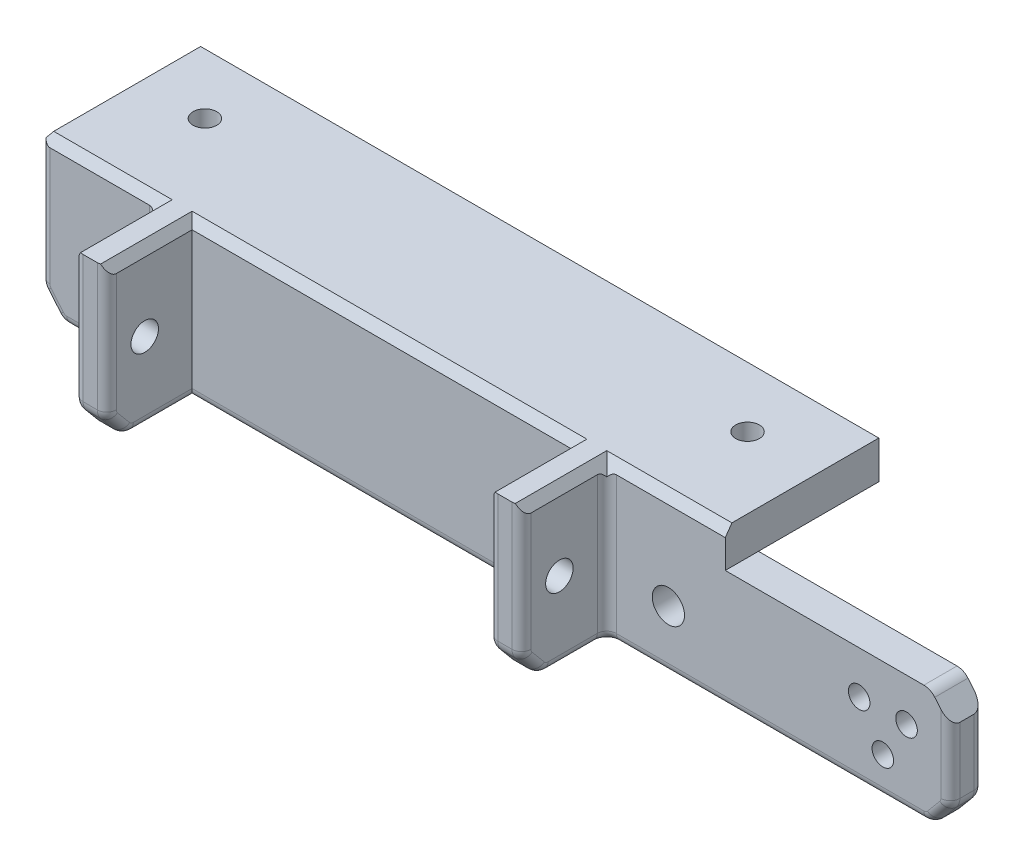
from build123d import *
from OCP.BRepFilletAPI import BRepFilletAPI_MakeChamfer

# Parameters (mm, degrees)
BOSS_EXTRUDE1_DEPTH = 12.5
SKETCH2_R           = 3.4
CUT_EXTRUDE1_DEPTH  = 122.738705842
SKETCH4_R           = 2.5
BOSS_EXTRUDE2_DEPTH = 8
SKETCH3_R           = 2.9
CUT_EXTRUDE2_DEPTH  = 171.159954161
CUT_EXTRUDE4_REACH  = 127.738
SKETCH8_R           = 2.275
CHAMFER1_SIZE       = 5
CHAMFER1_SIZE2      = 4.195498156
FILLET1_R           = 3
CHAMFER2_SIZE       = 2
CHAMFER2_SIZE2      = 1.400415076
FILLET2_R           = 2


with BuildPart() as part:
    # Sketch1 → Boss-Extrude1 (new, symmetric)
    with BuildSketch(Plane(origin=(0, 0, 0), x_dir=(1, 0, 0), z_dir=(0, 1, 0))):
        Polygon((119.75, 0), (119.75, -7), (47.25, -7), (47.25, -25), (40.25, -25), (40.25, -7), (-40.25, -7), (-40.25, -25), (-47.25, -25), (-47.25, -7), (-72.25, -7), (-72.25, 0), align=None)
    extrude(amount=BOSS_EXTRUDE1_DEPTH, both=True)

    # Sketch2 → Cut-Extrude1 (cut, through all)
    with BuildSketch(Plane.XY.offset(7)):
        with Locations((-60.25, 0)):
            Circle(SKETCH2_R)
        with Locations(Location((60.25, 0, 0), (0, 0, 180))):
            Circle(SKETCH2_R)
    extrude(amount=-CUT_EXTRUDE1_DEPTH, mode=Mode.SUBTRACT)

    # Sketch4 → Boss-Extrude2 (add)
    with BuildSketch(Plane(origin=(0, 12.5, 0), x_dir=(1, 0, 0), z_dir=(0, 1, 0))):
        Polygon((-72.25, -7), (-47.25, -7), (-47.25, -25), (-40.25, -25), (-40.25, -7), (40.25, -7), (40.25, -25), (47.25, -25), (47.25, -7), (72.25, -7), (72.25, 25.4), (-72.25, 25.4), align=None)
        with Locations(Location((-57.25, 12.7, 0), (0, 0, 270))):
            Circle(SKETCH4_R, mode=Mode.SUBTRACT)
        with Locations(Location((57.25, 12.7, 0), (0, 0, 270))):
            Circle(SKETCH4_R, mode=Mode.SUBTRACT)
    extrude(amount=BOSS_EXTRUDE2_DEPTH)

    # Sketch3 → Cut-Extrude2 (cut, through all)
    with BuildSketch(Plane.ZY.offset(47.25)):
        with Locations((17, 4)):
            Circle(SKETCH3_R)
    extrude(amount=-CUT_EXTRUDE2_DEPTH, mode=Mode.SUBTRACT)

    # Sketch8 → Cut-Extrude4 (cut, up to next)
    with BuildSketch(Plane.XY.offset(7), mode=Mode.PRIVATE) as cut_extrude4_sk1:
        with Locations((100.5, 3.5)):
            Circle(SKETCH8_R)
    cut_extrude4_tool1 = extrude(cut_extrude4_sk1.sketch, amount=-CUT_EXTRUDE4_REACH, mode=Mode.PRIVATE) & part.part
    # Sketch8 → Cut-Extrude4 (cut, up to next)
    with BuildSketch(Plane.XY.offset(7), mode=Mode.PRIVATE) as cut_extrude4_sk2:
        with Locations((110.5, 3.5)):
            Circle(SKETCH8_R)
    cut_extrude4_tool2 = extrude(cut_extrude4_sk2.sketch, amount=-CUT_EXTRUDE4_REACH, mode=Mode.PRIVATE) & part.part
    # Sketch8 → Cut-Extrude4 (cut, up to next)
    with BuildSketch(Plane.XY.offset(7), mode=Mode.PRIVATE) as cut_extrude4_sk3:
        with Locations((105.5, -4.5)):
            Circle(SKETCH8_R)
    cut_extrude4_tool3 = extrude(cut_extrude4_sk3.sketch, amount=-CUT_EXTRUDE4_REACH, mode=Mode.PRIVATE) & part.part
    add(cut_extrude4_tool1.solids().sort_by_distance((100.5, 3.5, 7))[0], mode=Mode.SUBTRACT)
    add(cut_extrude4_tool2.solids().sort_by_distance((110.5, 3.5, 7))[0], mode=Mode.SUBTRACT)
    add(cut_extrude4_tool3.solids().sort_by_distance((105.5, -4.5, 7))[0], mode=Mode.SUBTRACT)

    # Chamfer1: one chamfer whose edges measure the first distance from different faces: ONE call of the kernel's chamfer builder (chamfer() names one face for all edges)
    chamfer1_edges_1 = [part.edges().sort_by_distance(p)[0] for p in [
        (119.75, -12.5, 3.5),
        (119.75, 12.5, 3.5),
    ]]
    chamfer1_side_1 = [part.faces().sort_by_distance(p)[0] for p in [
        (119.75, 0, 3.5),
    ]]
    chamfer1_edges_2 = [part.edges().sort_by_distance(p)[0] for p in [
        (43.75, -12.5, 25),
    ]]
    chamfer1_side_2 = [part.faces().sort_by_distance(p)[0] for p in [
        (43.75, 4, 25),
    ]]
    chamfer1_edges_3 = [part.edges().sort_by_distance(p)[0] for p in [
        (-43.75, -12.5, 25),
    ]]
    chamfer1_side_3 = [part.faces().sort_by_distance(p)[0] for p in [
        (-43.75, 4, 25),
    ]]
    chamfer1_edges_4 = [part.edges().sort_by_distance(p)[0] for p in [
        (-72.25, -12.5, 3.5),
    ]]
    chamfer1_side_4 = [part.faces().sort_by_distance(p)[0] for p in [
        (-72.25, 4, 6.537532704),
    ]]
    chamfer1 = BRepFilletAPI_MakeChamfer(part.part.solid().wrapped)
    for e in chamfer1_edges_1:
        chamfer1.Add(CHAMFER1_SIZE, CHAMFER1_SIZE2, e.wrapped, chamfer1_side_1[0].wrapped)  # the first distance lies on this face
    for e in chamfer1_edges_2:
        chamfer1.Add(CHAMFER1_SIZE, CHAMFER1_SIZE2, e.wrapped, chamfer1_side_2[0].wrapped)  # the first distance lies on this face
    for e in chamfer1_edges_3:
        chamfer1.Add(CHAMFER1_SIZE, CHAMFER1_SIZE2, e.wrapped, chamfer1_side_3[0].wrapped)  # the first distance lies on this face
    for e in chamfer1_edges_4:
        chamfer1.Add(CHAMFER1_SIZE, CHAMFER1_SIZE2, e.wrapped, chamfer1_side_4[0].wrapped)  # the first distance lies on this face
    add(Compound.cast(chamfer1.Shape()), mode=Mode.REPLACE)

    # Fillet1
    fillet1_edges = [part.edges().sort_by_distance(p)[0] for p in [
        (115.554501844, 12.5, 3.5),
        (119.75, -7.5, 3.5),
        (-43.75, -12.5, 20.804501844),
        (43.75, -12.5, 20.804501844),
        (-68.054501844, -12.5, 3.5),
        (115.554501844, -12.5, 3.5),
        (-72.25, -7.5, 3.5),
        (43.75, -7.5, 25),
        (-43.75, -7.5, 25),
    ]]
    fillet(fillet1_edges, radius=FILLET1_R)

    # Chamfer2: one chamfer whose edges measure the first distance from different faces: ONE call of the kernel's chamfer builder (chamfer() names one face for all edges)
    chamfer2_edges_1 = [part.edges().sort_by_distance(p)[0] for p in [
        (-72.25, 20.5, -9.2),
    ]]
    chamfer2_side_1 = [part.faces().sort_by_distance(p)[0] for p in [
        (-72.25, 7.045955351, 6.578834324),
    ]]
    chamfer2_edges_2 = [part.edges().sort_by_distance(p)[0] for p in [
        (-59.75, 20.5, 7),
    ]]
    chamfer2_side_2 = [part.faces().sort_by_distance(p)[0] for p in [
        (-59.571971044, 4.394421722, 7),
    ]]
    chamfer2_edges_3 = [part.edges().sort_by_distance(p)[0] for p in [
        (-47.25, 20.5, 16),
    ]]
    chamfer2_side_3 = [part.faces().sort_by_distance(p)[0] for p in [
        (-47.25, -12.124101077, 13.202789435),
    ]]
    chamfer2_edges_4 = [part.edges().sort_by_distance(p)[0] for p in [
        (-40.25, 20.5, 16),
    ]]
    chamfer2_side_4 = [part.faces().sort_by_distance(p)[0] for p in [
        (-40.25, -12.124101077, 13.202789435),
    ]]
    chamfer2_edges_5 = [part.edges().sort_by_distance(p)[0] for p in [
        (0, 20.5, 7),
    ]]
    chamfer2_side_5 = [part.faces().sort_by_distance(p)[0] for p in [
        (0, 4, 7),
    ]]
    chamfer2_edges_6 = [part.edges().sort_by_distance(p)[0] for p in [
        (40.25, 20.5, 16),
    ]]
    chamfer2_side_6 = [part.faces().sort_by_distance(p)[0] for p in [
        (40.25, -12.124101077, 13.202789435),
    ]]
    chamfer2_edges_7 = [part.edges().sort_by_distance(p)[0] for p in [
        (47.25, 20.5, 16),
    ]]
    chamfer2_side_7 = [part.faces().sort_by_distance(p)[0] for p in [
        (47.25, -12.124101077, 13.202789435),
    ]]
    chamfer2_edges_8 = [part.edges().sort_by_distance(p)[0] for p in [
        (59.75, 20.5, 7),
    ]]
    chamfer2_side_8 = [part.faces().sort_by_distance(p)[0] for p in [
        (80.49228868, 1.71079357, 7),
    ]]
    chamfer2 = BRepFilletAPI_MakeChamfer(part.part.solid().wrapped)
    for e in chamfer2_edges_1:
        chamfer2.Add(CHAMFER2_SIZE, CHAMFER2_SIZE2, e.wrapped, chamfer2_side_1[0].wrapped)  # the first distance lies on this face
    for e in chamfer2_edges_2:
        chamfer2.Add(CHAMFER2_SIZE, CHAMFER2_SIZE2, e.wrapped, chamfer2_side_2[0].wrapped)  # the first distance lies on this face
    for e in chamfer2_edges_3:
        chamfer2.Add(CHAMFER2_SIZE, CHAMFER2_SIZE2, e.wrapped, chamfer2_side_3[0].wrapped)  # the first distance lies on this face
    for e in chamfer2_edges_4:
        chamfer2.Add(CHAMFER2_SIZE, CHAMFER2_SIZE2, e.wrapped, chamfer2_side_4[0].wrapped)  # the first distance lies on this face
    for e in chamfer2_edges_5:
        chamfer2.Add(CHAMFER2_SIZE, CHAMFER2_SIZE2, e.wrapped, chamfer2_side_5[0].wrapped)  # the first distance lies on this face
    for e in chamfer2_edges_6:
        chamfer2.Add(CHAMFER2_SIZE, CHAMFER2_SIZE2, e.wrapped, chamfer2_side_6[0].wrapped)  # the first distance lies on this face
    for e in chamfer2_edges_7:
        chamfer2.Add(CHAMFER2_SIZE, CHAMFER2_SIZE2, e.wrapped, chamfer2_side_7[0].wrapped)  # the first distance lies on this face
    for e in chamfer2_edges_8:
        chamfer2.Add(CHAMFER2_SIZE, CHAMFER2_SIZE2, e.wrapped, chamfer2_side_8[0].wrapped)  # the first distance lies on this face
    add(Compound.cast(chamfer2.Shape()), mode=Mode.REPLACE)

    # Fillet2
    fillet2_edges = [part.edges().sort_by_distance(p)[0] for p in [
        (-72.25, 6.045955351, 7),
        (-72.069077862, -7.434149727, 7),
        (-70.250922764, -9.882407478, 7),
        (-67.923433655, -12.218923361, 7),
        (-56.952789435, -12.5, 7),
        (119.569077862, -7.434149727, 7),
        (117.750922764, -9.882407478, 7),
        (115.423433655, -12.218923361, 7),
        (119.75, 0.545955351, 0),
        (119.569077862, -7.434149727, 0),
        (117.750922764, -9.882407478, 0),
        (115.423433655, -12.218923361, 0),
        (-72.25, 3.045955351, 0),
        (-72.069077862, -7.434149727, 0),
        (-70.250922764, -9.882407478, 0),
        (-67.923433655, -12.218923361, 0),
        (47.25, -12.5, 13.202789435),
        (47.25, -12.218923361, 20.673433655),
        (47.25, -9.882407478, 23.000922764),
        (47.25, -7.434149727, 24.819077862),
        (40.25, -12.5, 13.202789435),
        (40.25, -12.218923361, 20.673433655),
        (40.25, -9.882407478, 23.000922764),
        (40.25, -7.434149727, 24.819077862),
        (-40.25, -12.5, 13.202789435),
        (-40.25, -12.218923361, 20.673433655),
        (-40.25, -9.882407478, 23.000922764),
        (-40.25, -7.434149727, 24.819077862),
        (-47.25, -12.5, 13.202789435),
        (-47.25, -12.218923361, 20.673433655),
        (-47.25, -9.882407478, 23.000922764),
        (-47.25, -7.434149727, 24.819077862),
        (-47.25, 6.045955351, 25),
        (47.25, 3, 7),
        (80.702789435, -12.5, 7),
        (0, -12.5, 7),
        (23.75, -12.5, 0),
        (-47.25, 3, 7),
        (47.25, 6.045955351, 25),
        (40.25, 6.045955351, 25),
        (-40.25, 6.045955351, 25),
        (119.75, 0.545955351, 7),
    ]]
    fillet(fillet2_edges, radius=FILLET2_R)


solid = part.part
